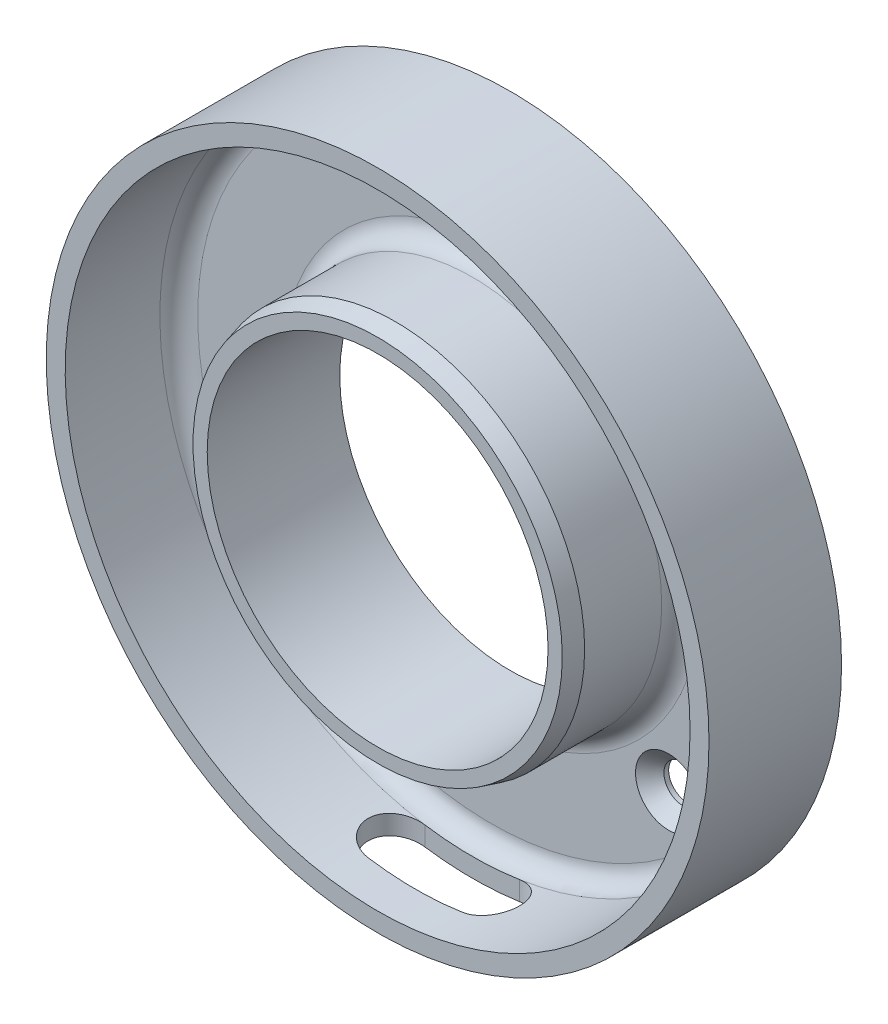
from build123d import *

# Parameters (mm, degrees)
CROQUIS1_R              = 35
SALIENTE_EXTRUIR1_DEPTH = 14
CROQUIS2_R              = 18
CORTAR_EXTRUIR1_DEPTH   = 52.439284598
VACIADO1_T              = -2
REDONDEO1_R             = 2
CORTAR_EXTRUIR2_START   = -22
CORTAR_EXTRUIR2_DEPTH   = 30.439284598
CROQUIS4_R              = 2
CORTAR_EXTRUIR3_DEPTH   = 51.931326474
CHAFL_N1_SIZE           = 1.5
CHAFL_N2_SIZE           = 0.5
CHAFL_N2_SIZE2          = 1.866025404


with BuildPart() as part:
    # Croquis1 → Saliente-Extruir1 (new body)
    with BuildSketch(Plane.XY):
        Circle(CROQUIS1_R)
    extrude(amount=SALIENTE_EXTRUIR1_DEPTH)

    # Croquis2 → Cortar-Extruir1 (cut, through all)
    with BuildSketch(Plane.XY.offset(14)):
        Circle(CROQUIS2_R)
    extrude(amount=-CORTAR_EXTRUIR1_DEPTH, mode=Mode.SUBTRACT)

    # Vaciado1
    vaciado1_openings = [part.faces().sort_by_distance(p)[0] for p in [
        (-34.010050506, 0, 14),
    ]]
    offset(amount=VACIADO1_T, openings=vaciado1_openings, kind=Kind.INTERSECTION)

    # Redondeo1
    redondeo1_edges = [part.edges().sort_by_distance(p)[0] for p in [
        (-33, 0, 2),
        (-20, 0, 2),
    ]]
    fillet(redondeo1_edges, radius=REDONDEO1_R)

    # Croquis3 → Cortar-Extruir2 (cut, through all)
    with BuildSketch(Plane(origin=(0, 0, 0), x_dir=(1, 0, 0), z_dir=(0, 1, 0)).offset(CORTAR_EXTRUIR2_START)):
        with BuildLine():
            Line((-5, -4), (5, -4))
            ThreePointArc((5, -4), (8, -7), (5, -10))
            Line((5, -10), (-5, -10))
            ThreePointArc((-5, -10), (-8, -7), (-5, -4))
        make_face()
    extrude(amount=-CORTAR_EXTRUIR2_DEPTH, mode=Mode.SUBTRACT)

    # Croquis4 → Cortar-Extruir3 (cut, through all)
    with BuildSketch(Plane.XY.offset(2)):
        with Locations((-18.738329701, -18.738329701)):
            Circle(CROQUIS4_R)
        with Locations((18.738329701, -18.738329701)):
            Circle(CROQUIS4_R)
        Polygon((-8.115597392, -27.870752521), (-9.499112417, -27.112050733), (-9.05906538, -26.309612019), (-10.984489851, -26.871194156), (-10.422907714, -28.796618627), (-10.021777616, -28.065146095), (-8.638262591, -28.823847883), align=None)
    extrude(amount=-CORTAR_EXTRUIR3_DEPTH, mode=Mode.SUBTRACT)

    # Chaflán1
    chafl_n1_edges = [part.edges().sort_by_distance(p)[0] for p in [
        (-20.738329701, -18.738329701, 2),
        (16.738329701, -18.738329701, 2),
    ]]
    chamfer(chafl_n1_edges, length=CHAFL_N1_SIZE)

    # Chaflán2
    chafl_n2_edges = [part.edges().sort_by_distance(p)[0] for p in [
        (-20, 0, 14),
    ]]
    chafl_n2_side = [part.faces().sort_by_distance(p)[0] for p in [
        (-19.434314575, 0, 14),
    ]]
    chamfer(chafl_n2_edges, length=CHAFL_N2_SIZE, length2=CHAFL_N2_SIZE2, reference=chafl_n2_side[0])


solid = part.part
